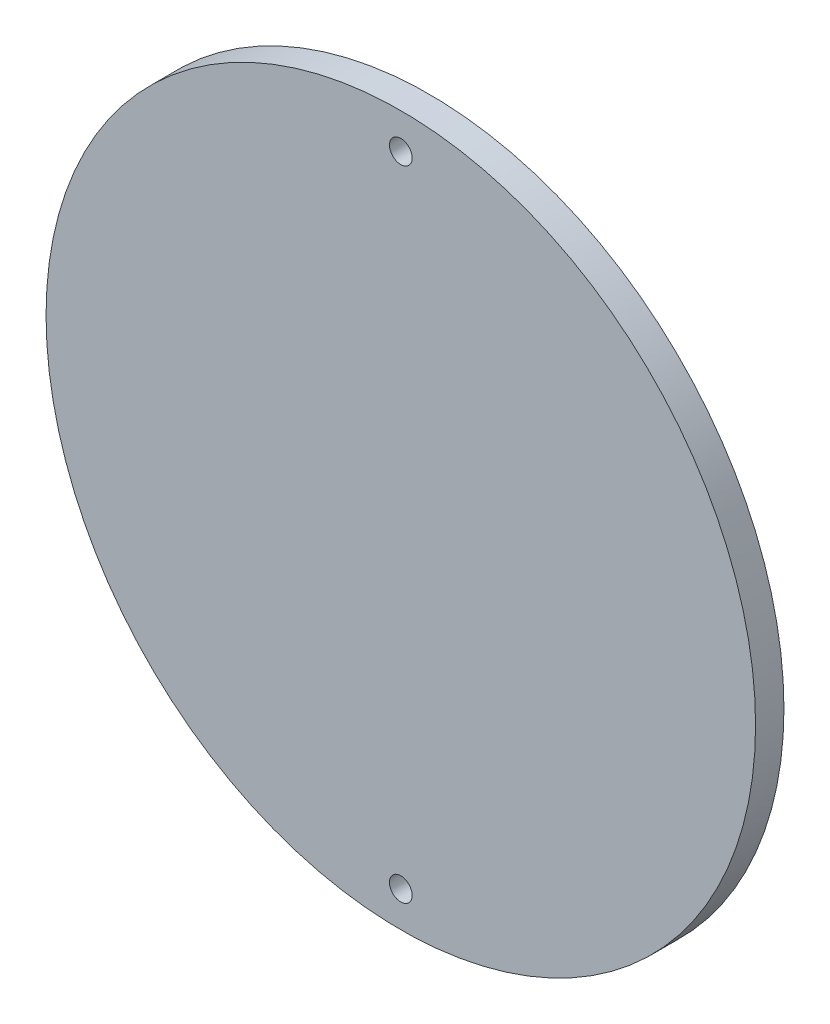
from build123d import *

# Parameters (mm, degrees)
SKETCH_1_R      = 50
SKETCH_1_R_2    = 1.6
EXTRUDE_1_DEPTH = 4


with BuildPart() as part:
    # 草图1 → 凸台-拉伸1 (new body)
    with BuildSketch(Plane.XY):
        Circle(SKETCH_1_R)
        with Locations((0, 45)):
            Circle(SKETCH_1_R_2, mode=Mode.SUBTRACT)
        with Locations((0, -45)):
            Circle(SKETCH_1_R_2, mode=Mode.SUBTRACT)
    extrude(amount=EXTRUDE_1_DEPTH)


solid = part.part
